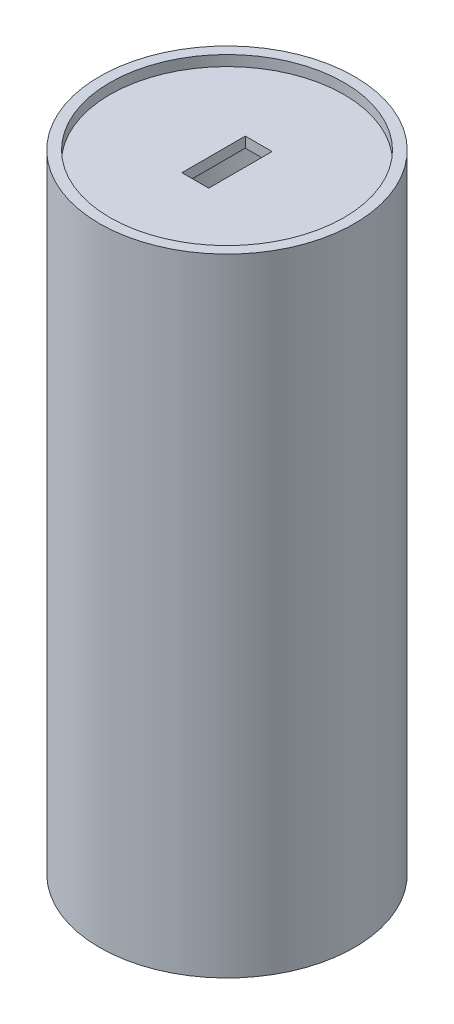
from build123d import *

# Parameters (mm, degrees)
SKETCH1_R           = 61
SKETCH1_R_2         = 56
BOSS_EXTRUDE1_DEPTH = 300
SKETCH3_R           = 56
BOSS_EXTRUDE2_DEPTH = 5
CUT_EXTRUDE1_REACH  = 294.988
SKETCH4_R           = 1.5
SKETCH5_R           = 56
BOSS_EXTRUDE3_DEPTH = 5
CUT_EXTRUDE2_REACH  = 309.355
SKETCH6_W           = 12.82
SKETCH6_H           = 30.34


with BuildPart() as part:
    # Sketch1 → Boss-Extrude1 (new body)
    with BuildSketch(Plane(origin=(0, 0, 0), x_dir=(1, 0, 0), z_dir=(0, 1, 0))):
        with Locations(Location((0, 0, 0), (0, 0, 270))):
            Circle(SKETCH1_R)
        with Locations(Location((0, 0, 0), (0, 0, 270))):
            Circle(SKETCH1_R_2, mode=Mode.SUBTRACT)
    extrude(amount=BOSS_EXTRUDE1_DEPTH)

    # Sketch3 → Boss-Extrude2 (add)
    with BuildSketch(Plane(origin=(0, 20, 0), x_dir=(1, 0, 0), z_dir=(0, 1, 0))):
        with Locations(Location((0, 0, 0), (0, 0, 270))):
            Circle(SKETCH3_R)
    extrude(amount=BOSS_EXTRUDE2_DEPTH)

    # Sketch4 → Cut-Extrude1 (cut, up to next)
    with BuildSketch(Plane.XZ.offset(-20), mode=Mode.PRIVATE) as cut_extrude1_sk1:
        with Locations(Location((10, 0, 0), (0, 0, 270))):
            Circle(SKETCH4_R)
    cut_extrude1_tool1 = extrude(cut_extrude1_sk1.sketch, amount=-CUT_EXTRUDE1_REACH, mode=Mode.PRIVATE) & part.part
    # Sketch4 → Cut-Extrude1 (cut, up to next)
    with BuildSketch(Plane.XZ.offset(-20), mode=Mode.PRIVATE) as cut_extrude1_sk2:
        with Locations(Location((0, 10, 0), (0, 0, 270))):
            Circle(SKETCH4_R)
    cut_extrude1_tool2 = extrude(cut_extrude1_sk2.sketch, amount=-CUT_EXTRUDE1_REACH, mode=Mode.PRIVATE) & part.part
    # Sketch4 → Cut-Extrude1 (cut, up to next)
    with BuildSketch(Plane.XZ.offset(-20), mode=Mode.PRIVATE) as cut_extrude1_sk3:
        with Locations(Location((-10, 0, 0), (0, 0, 270))):
            Circle(SKETCH4_R)
    cut_extrude1_tool3 = extrude(cut_extrude1_sk3.sketch, amount=-CUT_EXTRUDE1_REACH, mode=Mode.PRIVATE) & part.part
    # Sketch4 → Cut-Extrude1 (cut, up to next)
    with BuildSketch(Plane.XZ.offset(-20), mode=Mode.PRIVATE) as cut_extrude1_sk4:
        with Locations(Location((0, -10, 0), (0, 0, 270))):
            Circle(SKETCH4_R)
    cut_extrude1_tool4 = extrude(cut_extrude1_sk4.sketch, amount=-CUT_EXTRUDE1_REACH, mode=Mode.PRIVATE) & part.part
    add(cut_extrude1_tool1.solids().sort_by_distance((10, 20, 0))[0], mode=Mode.SUBTRACT)
    add(cut_extrude1_tool2.solids().sort_by_distance((0, 20, 10))[0], mode=Mode.SUBTRACT)
    add(cut_extrude1_tool3.solids().sort_by_distance((-10, 20, 0))[0], mode=Mode.SUBTRACT)
    add(cut_extrude1_tool4.solids().sort_by_distance((0, 20, -10))[0], mode=Mode.SUBTRACT)

    # Sketch5 → Boss-Extrude3 (add)
    with BuildSketch(Plane(origin=(0, 290, 0), x_dir=(1, 0, 0), z_dir=(0, 1, 0))):
        with Locations(Location((0, 0, 0), (0, 0, 270))):
            Circle(SKETCH5_R)
    extrude(amount=BOSS_EXTRUDE3_DEPTH)

    # Sketch6 → Cut-Extrude2 (cut, up to next)
    with BuildSketch(Plane(origin=(0, 295, 0), x_dir=(1, 0, 0), z_dir=(0, 1, 0)), mode=Mode.PRIVATE) as cut_extrude2_sk1:
        Rectangle(SKETCH6_W, SKETCH6_H)
    cut_extrude2_tool1 = extrude(cut_extrude2_sk1.sketch, amount=-CUT_EXTRUDE2_REACH, mode=Mode.PRIVATE) & part.part
    add(cut_extrude2_tool1.solids().sort_by_distance((0, 295, 0))[0], mode=Mode.SUBTRACT)


solid = part.part
